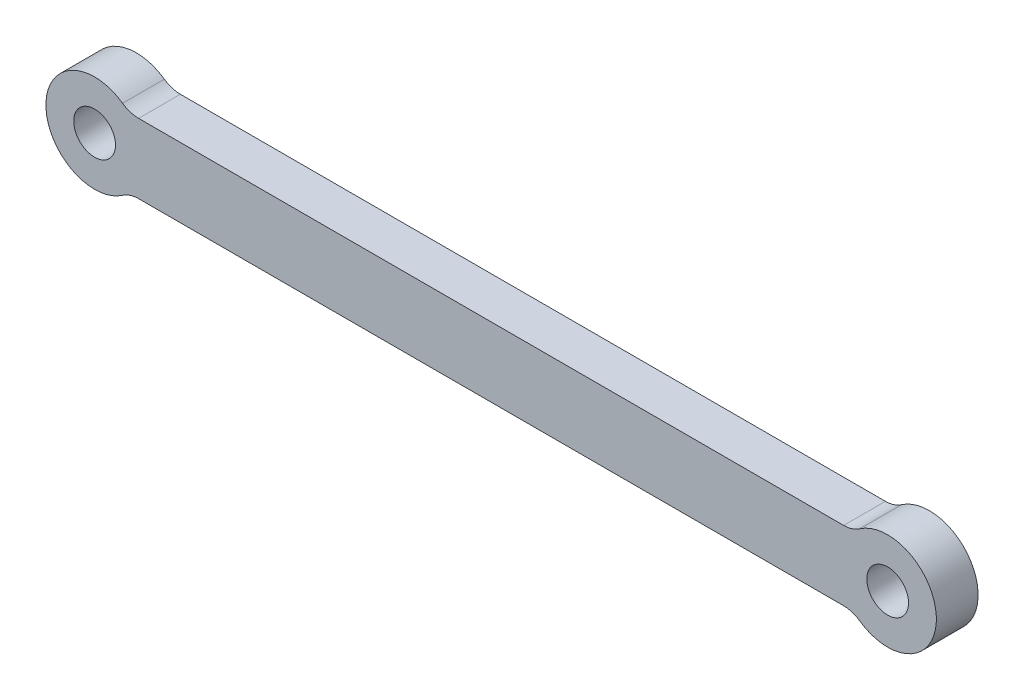
from build123d import *

# Parameters (mm, degrees)
SKETCH_1_R      = 1.5
EXTRUDE_1_DEPTH = 3


with BuildPart() as part:
    # 草图1 → 凸台-拉伸1 (new body)
    with BuildSketch(Plane.XY):
        with BuildLine():
            Line((3.16227766, 2.5), (53.83772234, 2.5))
            ThreePointArc((53.83772234, 2.5), (54.440745029, 2.593074822), (54.987641489, 2.863636364))
            ThreePointArc((54.987641489, 2.863636364), (60.5, 0), (54.987641489, -2.863636364))
            ThreePointArc((54.987641489, -2.863636364), (54.440745029, -2.593074822), (53.83772234, -2.5))
            Line((53.83772234, -2.5), (3.16227766, -2.5))
            ThreePointArc((3.16227766, -2.5), (2.559254971, -2.593074822), (2.012358511, -2.863636364))
            ThreePointArc((2.012358511, -2.863636364), (-3.5, 0), (2.012358511, 2.863636364))
            ThreePointArc((2.012358511, 2.863636364), (2.559254971, 2.593074822), (3.16227766, 2.5))
        make_face()
        Circle(SKETCH_1_R, mode=Mode.SUBTRACT)
        with Locations((57, 0)):
            Circle(SKETCH_1_R, mode=Mode.SUBTRACT)
    extrude(amount=EXTRUDE_1_DEPTH)


solid = part.part
